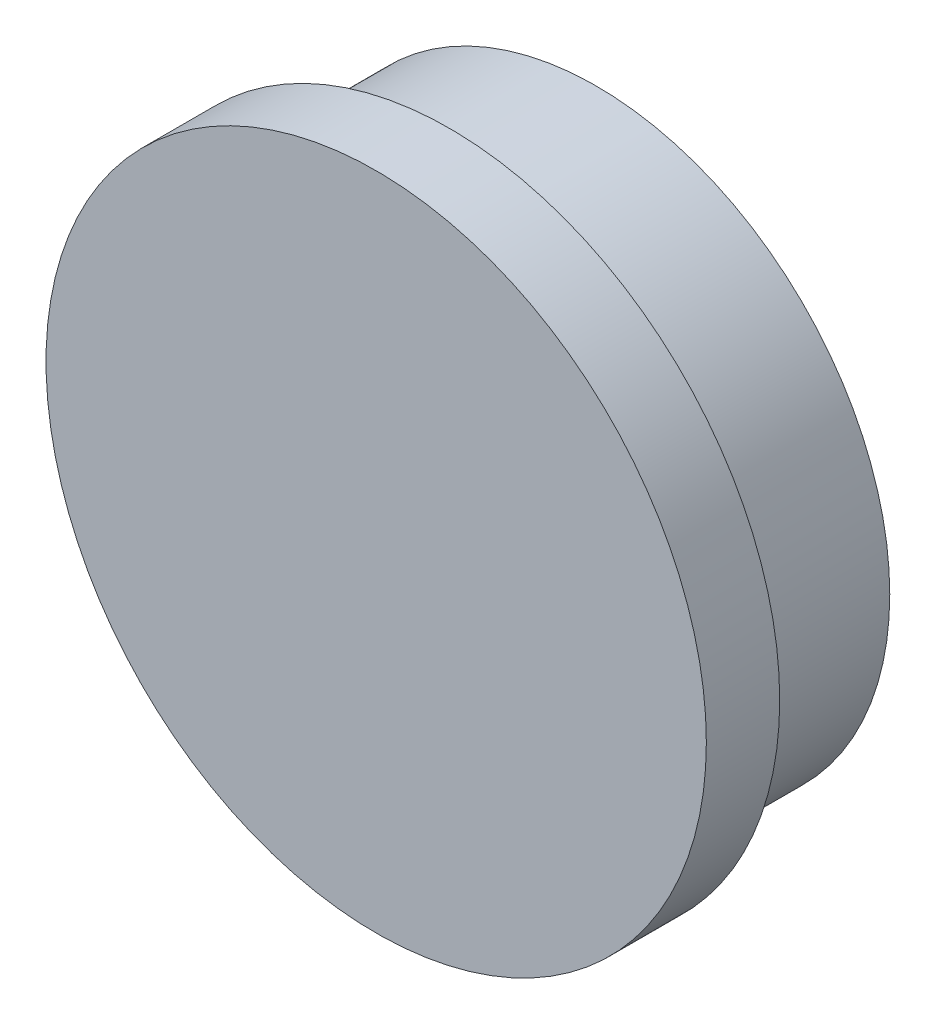
from build123d import *

# Parameters (mm, degrees)
SKETCH1_R           = 11.25
BOSS_EXTRUDE1_DEPTH = 2.5
SKETCH2_R           = 10
BOSS_EXTRUDE2_DEPTH = 7.5


with BuildPart() as part:
    # Sketch1 → Boss-Extrude1 (new body)
    with BuildSketch(Plane.XY):
        Circle(SKETCH1_R)
    extrude(amount=BOSS_EXTRUDE1_DEPTH)

    # Sketch2 → Boss-Extrude2 (add)
    with BuildSketch(Plane.XY.offset(2.5)):
        Circle(SKETCH2_R)
    extrude(amount=-BOSS_EXTRUDE2_DEPTH)


solid = part.part
